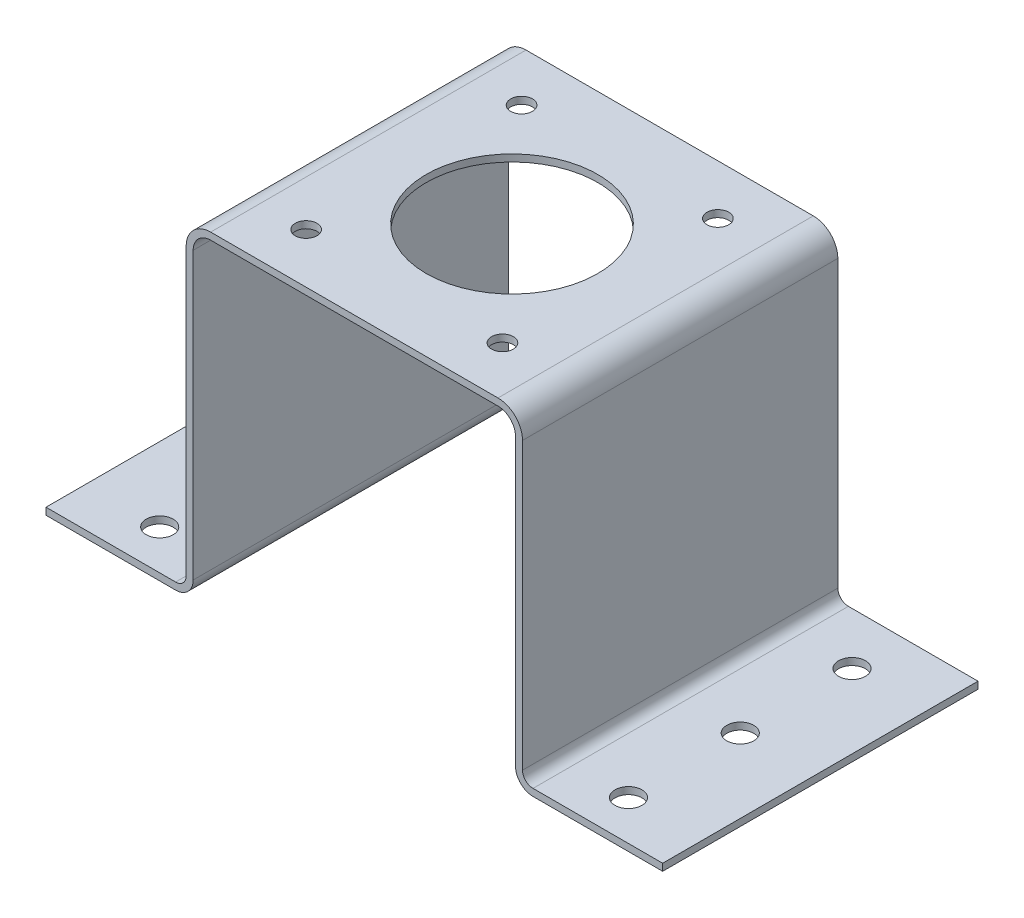
from build123d import *

# Parameters (mm, degrees)
BOSS_EXTRUDE1_DEPTH = 45.72
SKETCH2_R           = 12.446
CUT_EXTRUDE1_DEPTH  = 112.086312694
SKETCH3_R           = 1.5748
CUT_EXTRUDE2_DEPTH  = 112.086312694
SKETCH4_R           = 1.9558
CUT_EXTRUDE3_DEPTH  = 45.72


with BuildPart() as part:
    # Sketch1 → Boss-Extrude1 (new body)
    with BuildSketch(Plane.XY):
        with BuildLine():
            Line((0, 0), (18.796, 0))
            ThreePointArc((18.796, 0), (20.592051224, 0.743948776), (21.336, 2.54))
            Line((21.336, 2.54), (21.336, 43.942))
            ThreePointArc((21.336, 43.942), (22.079948776, 45.738051224), (23.876, 46.482))
            Line((23.876, 46.482), (65.532, 46.482))
            ThreePointArc((65.532, 46.482), (67.328051224, 45.738051224), (68.072, 43.942))
            Line((68.072, 43.942), (68.072, 2.54))
            ThreePointArc((68.072, 2.54), (68.815948776, 0.743948776), (70.612, 0))
            Line((70.612, 0), (89.408, 0))
            Line((89.408, 0), (89.408, 1.016))
            Line((89.408, 1.016), (70.612, 1.016))
            ThreePointArc((70.612, 1.016), (69.534369265, 1.462369265), (69.088, 2.54))
            Line((69.088, 2.54), (69.088, 43.942))
            ThreePointArc((69.088, 43.942), (68.046471714, 46.456471714), (65.532, 47.498))
            Line((65.532, 47.498), (23.876, 47.498))
            ThreePointArc((23.876, 47.498), (21.361528286, 46.456471714), (20.32, 43.942))
            Line((20.32, 43.942), (20.32, 2.54))
            ThreePointArc((20.32, 2.54), (19.873630735, 1.462369265), (18.796, 1.016))
            Line((18.796, 1.016), (0, 1.016))
            Line((0, 1.016), (0, 0))
        make_face()
    extrude(amount=BOSS_EXTRUDE1_DEPTH)

    # Sketch2 → Cut-Extrude1 (cut, through all)
    with BuildSketch(Plane(origin=(0, 47.498, 0), x_dir=(1, 0, 0), z_dir=(0, 1, 0))):
        with Locations(Location((44.704, -22.86, 0), (0, 0, 270))):
            Circle(SKETCH2_R)
    extrude(amount=-CUT_EXTRUDE1_DEPTH, mode=Mode.SUBTRACT)

    # Sketch3 → Cut-Extrude2 (cut, through all)
    with BuildSketch(Plane(origin=(0, 47.498, 0), x_dir=(1, 0, 0), z_dir=(0, 1, 0))):
        with Locations(Location((58.936729391, -7.238711644, 0), (0, 0, 270))):
            Circle(SKETCH3_R)
        with Locations(Location((30.471270609, -7.238711644, 0), (0, 0, 270))):
            Circle(SKETCH3_R)
        with Locations(Location((58.936729391, -38.481288356, 0), (0, 0, 270))):
            Circle(SKETCH3_R)
        with Locations(Location((30.471270609, -38.481288356, 0), (0, 0, 270))):
            Circle(SKETCH3_R)
    extrude(amount=-CUT_EXTRUDE2_DEPTH, mode=Mode.SUBTRACT)

    # Sketch4 → Cut-Extrude3 (cut)
    with BuildSketch(Plane(origin=(0, 1.016, 0), x_dir=(1, 0, 0), z_dir=(0, 1, 0))):
        with Locations(Location((10.7188, -7.5438, 0), (0, 0, 270))):
            Circle(SKETCH4_R)
        with Locations(Location((10.7188, -23.749, 0), (0, 0, 270))):
            Circle(SKETCH4_R)
        with Locations(Location((10.7188, -39.9542, 0), (0, 0, 270))):
            Circle(SKETCH4_R)
    cut_extrude3 = extrude(amount=-CUT_EXTRUDE3_DEPTH, mode=Mode.SUBTRACT)

    # Mirror1: Cut-Extrude3 across plane
    add(cut_extrude3.mirror(Plane.ZY.offset(-44.704)), mode=Mode.SUBTRACT)


solid = part.part
